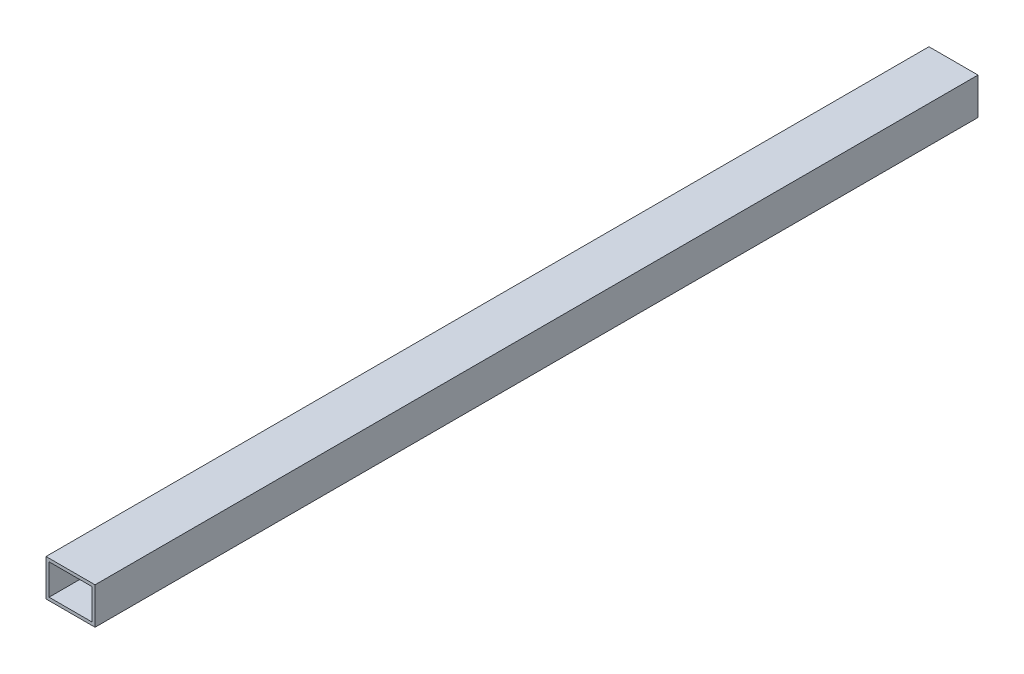
from build123d import *

# Parameters (mm, degrees)
BOSS_EXTRUDE1_DEPTH      = 457.2
BOSS_EXTRUDE1_DEPTH_BACK = 457.2
SKETCH3_W                = 50.8
SKETCH3_H                = 38.1
SKETCH3_W_2              = 44.45
SKETCH3_H_2              = 31.75


with BuildPart() as part:
    # Sketch3 → Boss-Extrude1 (new, two sides: drawn at the far end of the back side and taken through both)
    with BuildSketch(Plane.XY.offset(-BOSS_EXTRUDE1_DEPTH_BACK)):
        Rectangle(SKETCH3_W, SKETCH3_H)
        Rectangle(SKETCH3_W_2, SKETCH3_H_2, mode=Mode.SUBTRACT)
    extrude(amount=BOSS_EXTRUDE1_DEPTH + BOSS_EXTRUDE1_DEPTH_BACK)


solid = part.part
